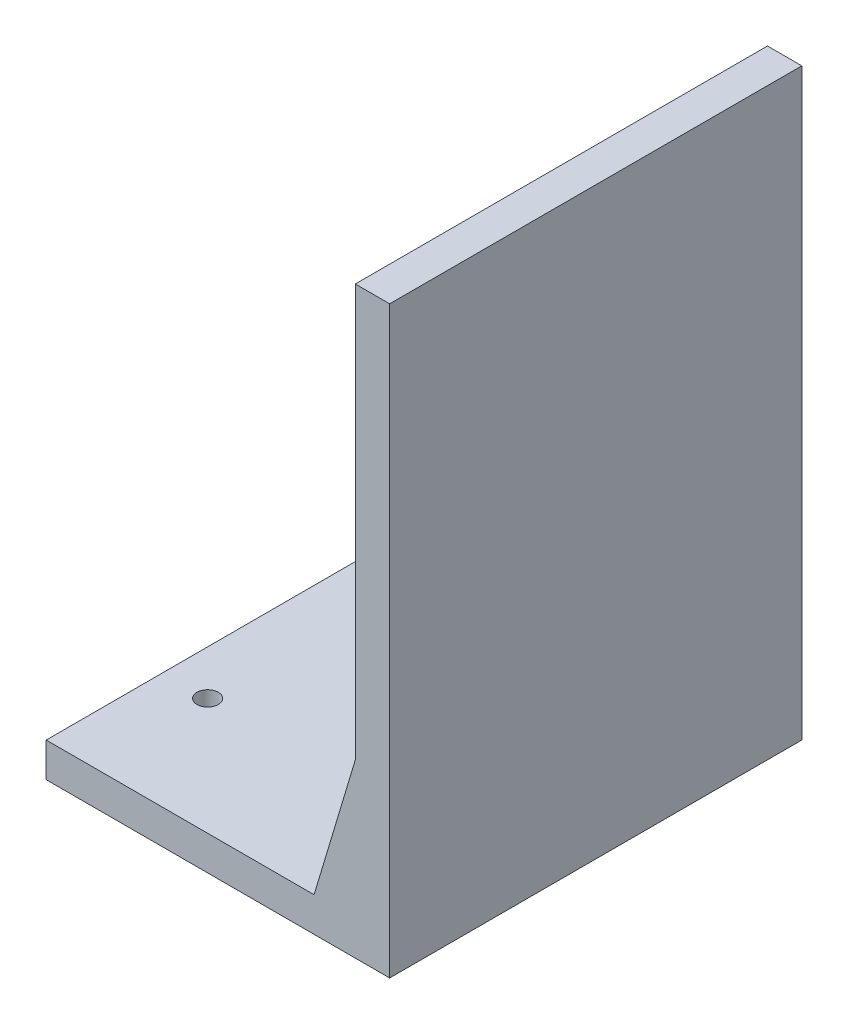
from build123d import *

# Parameters (mm, degrees)
SKETCH_2_W          = 50
SKETCH_2_H          = 60
EXTRUDE_1_DEPTH     = 5
SKETCH_3_W          = 5
SKETCH_3_H          = 60
EXTRUDE_2_DEPTH     = 80
EXTRUDE_3_DEPTH     = 10
EXTRUDE_4_DEPTH     = 10
EXTRUDE_5_DEPTH     = 5
SKETCH_7_R          = 1.55
CUT_EXTRUDE_1_DEPTH = 112.803398875


with BuildPart() as part:
    # 草图2 → 凸台-拉伸1 (new body)
    with BuildSketch(Plane(origin=(0, 0, 0), x_dir=(1, 0, 0), z_dir=(0, 1, 0))):
        with Locations((25, 30)):
            Rectangle(SKETCH_2_W, SKETCH_2_H)
    extrude(amount=EXTRUDE_1_DEPTH)

    # 草图3 → 凸台-拉伸2 (add)
    with BuildSketch(Plane(origin=(0, 5, 0), x_dir=(1, 0, 0), z_dir=(0, 1, 0))):
        with Locations((47.5, 30)):
            Rectangle(SKETCH_3_W, SKETCH_3_H)
    extrude(amount=EXTRUDE_2_DEPTH)

    # 草图4 → 凸台-拉伸3 (add)
    with BuildSketch(Plane.XY):
        Polygon((39, 5), (45, 25), (45, 5), align=None)
    extrude(amount=-EXTRUDE_3_DEPTH)

    # 草图5 → 凸台-拉伸4 (add)
    with BuildSketch(Plane(origin=(0, 0, -60), x_dir=(-1, 0, 0), z_dir=(0, 0, -1))):
        Polygon((-39, 5), (-45, 25), (-45, 5), align=None)
    extrude(amount=-EXTRUDE_4_DEPTH)

    # 草图6 → 凸台-拉伸5 (add, symmetric)
    with BuildSketch(Plane(origin=(0, 0, -30), x_dir=(-1, 0, 0), z_dir=(0, 0, -1))):
        Polygon((-39, 5), (-45, 25), (-45, 5), align=None)
    extrude(amount=EXTRUDE_5_DEPTH, both=True)

    # 草图7 → 切除-拉伸1 (cut, through all)
    with BuildSketch(Plane(origin=(0, 5, 0), x_dir=(1, 0, 0), z_dir=(0, 1, 0))):
        with Locations(Location((6.5, 43, 0), (0, 0, 270))):
            Circle(SKETCH_7_R)
        with Locations(Location((32.5, 43, 0), (0, 0, 90))):
            Circle(SKETCH_7_R)
        with Locations(Location((6.5, 17, 0), (0, 0, 90))):
            Circle(SKETCH_7_R)
        with Locations(Location((32.5, 17, 0), (0, 0, 270))):
            Circle(SKETCH_7_R)
    extrude(amount=-CUT_EXTRUDE_1_DEPTH, mode=Mode.SUBTRACT)


solid = part.part
